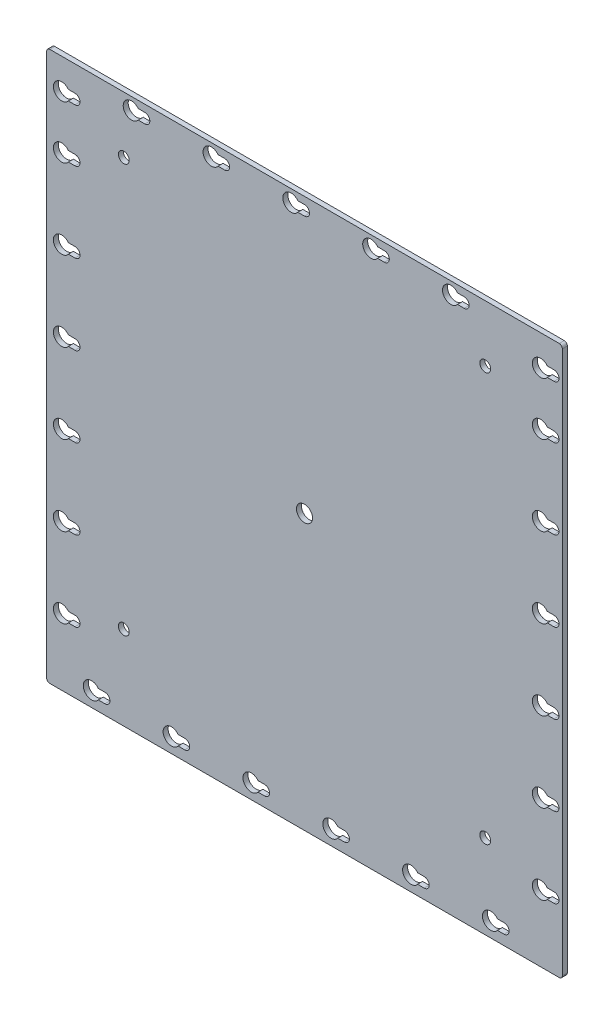
from build123d import *

# Parameters (mm, degrees)
SKETCH1_W               = 164.1
SKETCH1_H               = 174.745
SKETCH1_R               = 2.5527
BOSS_EXTRUDE1_DEPTH     = 1.5875
FILLET1_R               = 1
CUT_EXTRUDE1_DEPTH      = 241.065605994
CUT_EXTRUDE1_DEPTH_BACK = 241.065605994
SKETCH2_R               = 1.725


with BuildPart() as part:
    # Sketch1 → Boss-Extrude1 (new body)
    with BuildSketch(Plane.XY):
        with Locations((82.55, -87.3725)):
            Rectangle(SKETCH1_W, SKETCH1_H)
        with Locations((82.55, -87.3725)):
            Circle(SKETCH1_R, mode=Mode.SUBTRACT)
        with BuildLine():
            Line((82.55, -5.4375), (80.434372699, -5.4375))
            ThreePointArc((80.434372699, -5.4375), (75.6625, -3.85), (80.434372699, -2.2625))
            Line((80.434372699, -2.2625), (82.55, -2.2625))
            ThreePointArc((82.55, -2.2625), (84.1375, -3.85), (82.55, -5.4375))
        make_face(mode=Mode.SUBTRACT)
        with BuildLine():
            Line((16.934372699, -168.395), (19.05, -168.395))
            ThreePointArc((19.05, -168.395), (20.6375, -169.9825), (19.05, -171.57))
            Line((19.05, -171.57), (16.934372699, -171.57))
            ThreePointArc((16.934372699, -171.57), (12.1625, -169.9825), (16.934372699, -168.395))
        make_face(mode=Mode.SUBTRACT)
        with BuildLine():
            Line((7.409372699, -151.9325), (9.525, -151.9325))
            ThreePointArc((9.525, -151.9325), (11.1125, -153.52), (9.525, -155.1075))
            Line((9.525, -155.1075), (7.409372699, -155.1075))
            ThreePointArc((7.409372699, -155.1075), (2.6375, -153.52), (7.409372699, -151.9325))
        make_face(mode=Mode.SUBTRACT)
        with BuildLine():
            Line((42.334372699, -168.395), (44.45, -168.395))
            ThreePointArc((44.45, -168.395), (46.0375, -169.9825), (44.45, -171.57))
            Line((44.45, -171.57), (42.334372699, -171.57))
            ThreePointArc((42.334372699, -171.57), (37.5625, -169.9825), (42.334372699, -168.395))
        make_face(mode=Mode.SUBTRACT)
        with BuildLine():
            Line((67.734372699, -168.395), (69.85, -168.395))
            ThreePointArc((69.85, -168.395), (71.4375, -169.9825), (69.85, -171.57))
            Line((69.85, -171.57), (67.734372699, -171.57))
            ThreePointArc((67.734372699, -171.57), (62.9625, -169.9825), (67.734372699, -168.395))
        make_face(mode=Mode.SUBTRACT)
        with BuildLine():
            Line((7.409372699, -126.5325), (9.525, -126.5325))
            ThreePointArc((9.525, -126.5325), (11.1125, -128.12), (9.525, -129.7075))
            Line((9.525, -129.7075), (7.409372699, -129.7075))
            ThreePointArc((7.409372699, -129.7075), (2.6375, -128.12), (7.409372699, -126.5325))
        make_face(mode=Mode.SUBTRACT)
        with BuildLine():
            Line((7.409372699, -101.1325), (9.525, -101.1325))
            ThreePointArc((9.525, -101.1325), (11.1125, -102.72), (9.525, -104.3075))
            Line((9.525, -104.3075), (7.409372699, -104.3075))
            ThreePointArc((7.409372699, -104.3075), (2.6375, -102.72), (7.409372699, -101.1325))
        make_face(mode=Mode.SUBTRACT)
        with BuildLine():
            Line((7.409372699, -75.7325), (9.525, -75.7325))
            ThreePointArc((9.525, -75.7325), (11.1125, -77.32), (9.525, -78.9075))
            Line((9.525, -78.9075), (7.409372699, -78.9075))
            ThreePointArc((7.409372699, -78.9075), (2.6375, -77.32), (7.409372699, -75.7325))
        make_face(mode=Mode.SUBTRACT)
        with BuildLine():
            Line((7.409372699, -50.3325), (9.525, -50.3325))
            ThreePointArc((9.525, -50.3325), (11.1125, -51.92), (9.525, -53.5075))
            Line((9.525, -53.5075), (7.409372699, -53.5075))
            ThreePointArc((7.409372699, -53.5075), (2.6375, -51.92), (7.409372699, -50.3325))
        make_face(mode=Mode.SUBTRACT)
        with BuildLine():
            Line((7.409372699, -24.9325), (9.525, -24.9325))
            ThreePointArc((9.525, -24.9325), (11.1125, -26.52), (9.525, -28.1075))
            Line((9.525, -28.1075), (7.409372699, -28.1075))
            ThreePointArc((7.409372699, -28.1075), (2.6375, -26.52), (7.409372699, -24.9325))
        make_face(mode=Mode.SUBTRACT)
        with BuildLine():
            Line((7.409372699, -8.1), (9.525, -8.1))
            ThreePointArc((9.525, -8.1), (11.1125, -9.6875), (9.525, -11.275))
            Line((9.525, -11.275), (7.409372699, -11.275))
            ThreePointArc((7.409372699, -11.275), (2.6375, -9.6875), (7.409372699, -8.1))
        make_face(mode=Mode.SUBTRACT)
        with BuildLine():
            Line((29.634372699, -2.2625), (31.75, -2.2625))
            ThreePointArc((31.75, -2.2625), (33.3375, -3.85), (31.75, -5.4375))
            Line((31.75, -5.4375), (29.634372699, -5.4375))
            ThreePointArc((29.634372699, -5.4375), (24.8625, -3.85), (29.634372699, -2.2625))
        make_face(mode=Mode.SUBTRACT)
        with BuildLine():
            Line((55.034372699, -2.2625), (57.15, -2.2625))
            ThreePointArc((57.15, -2.2625), (58.7375, -3.85), (57.15, -5.4375))
            Line((57.15, -5.4375), (55.034372699, -5.4375))
            ThreePointArc((55.034372699, -5.4375), (50.2625, -3.85), (55.034372699, -2.2625))
        make_face(mode=Mode.SUBTRACT)
        with BuildLine():
            ThreePointArc((161.925, -8.1), (163.5125, -9.6875), (161.925, -11.275))
            Line((161.925, -11.275), (159.809372699, -11.275))
            ThreePointArc((159.809372699, -11.275), (155.0375, -9.6875), (159.809372699, -8.1))
            Line((159.809372699, -8.1), (161.925, -8.1))
        make_face(mode=Mode.SUBTRACT)
        with BuildLine():
            Line((93.134372699, -168.395), (95.25, -168.395))
            ThreePointArc((95.25, -168.395), (96.8375, -169.9825), (95.25, -171.57))
            Line((95.25, -171.57), (93.134372699, -171.57))
            ThreePointArc((93.134372699, -171.57), (88.3625, -169.9825), (93.134372699, -168.395))
        make_face(mode=Mode.SUBTRACT)
        with BuildLine():
            Line((118.534372699, -168.395), (120.65, -168.395))
            ThreePointArc((120.65, -168.395), (122.2375, -169.9825), (120.65, -171.57))
            Line((120.65, -171.57), (118.534372699, -171.57))
            ThreePointArc((118.534372699, -171.57), (113.7625, -169.9825), (118.534372699, -168.395))
        make_face(mode=Mode.SUBTRACT)
        with BuildLine():
            Line((143.934372699, -168.395), (146.05, -168.395))
            ThreePointArc((146.05, -168.395), (147.6375, -169.9825), (146.05, -171.57))
            Line((146.05, -171.57), (143.934372699, -171.57))
            ThreePointArc((143.934372699, -171.57), (139.1625, -169.9825), (143.934372699, -168.395))
        make_face(mode=Mode.SUBTRACT)
        with BuildLine():
            Line((159.809372699, -151.9325), (161.925, -151.9325))
            ThreePointArc((161.925, -151.9325), (163.5125, -153.52), (161.925, -155.1075))
            Line((161.925, -155.1075), (159.809372699, -155.1075))
            ThreePointArc((159.809372699, -155.1075), (155.0375, -153.52), (159.809372699, -151.9325))
        make_face(mode=Mode.SUBTRACT)
        with BuildLine():
            Line((159.809372699, -126.5325), (161.925, -126.5325))
            ThreePointArc((161.925, -126.5325), (163.5125, -128.12), (161.925, -129.7075))
            Line((161.925, -129.7075), (159.809372699, -129.7075))
            ThreePointArc((159.809372699, -129.7075), (155.0375, -128.12), (159.809372699, -126.5325))
        make_face(mode=Mode.SUBTRACT)
        with BuildLine():
            Line((159.809372699, -101.1325), (161.925, -101.1325))
            ThreePointArc((161.925, -101.1325), (163.5125, -102.72), (161.925, -104.3075))
            Line((161.925, -104.3075), (159.809372699, -104.3075))
            ThreePointArc((159.809372699, -104.3075), (155.0375, -102.72), (159.809372699, -101.1325))
        make_face(mode=Mode.SUBTRACT)
        with BuildLine():
            Line((159.809372699, -75.7325), (161.925, -75.7325))
            ThreePointArc((161.925, -75.7325), (163.5125, -77.32), (161.925, -78.9075))
            Line((161.925, -78.9075), (159.809372699, -78.9075))
            ThreePointArc((159.809372699, -78.9075), (155.0375, -77.32), (159.809372699, -75.7325))
        make_face(mode=Mode.SUBTRACT)
        with BuildLine():
            Line((159.809372699, -50.3325), (161.925, -50.3325))
            ThreePointArc((161.925, -50.3325), (163.5125, -51.92), (161.925, -53.5075))
            Line((161.925, -53.5075), (159.809372699, -53.5075))
            ThreePointArc((159.809372699, -53.5075), (155.0375, -51.92), (159.809372699, -50.3325))
        make_face(mode=Mode.SUBTRACT)
        with BuildLine():
            Line((105.834372699, -2.2625), (107.95, -2.2625))
            ThreePointArc((107.95, -2.2625), (109.5375, -3.85), (107.95, -5.4375))
            Line((107.95, -5.4375), (105.834372699, -5.4375))
            ThreePointArc((105.834372699, -5.4375), (101.0625, -3.85), (105.834372699, -2.2625))
        make_face(mode=Mode.SUBTRACT)
        with BuildLine():
            Line((159.809372699, -24.9325), (161.925, -24.9325))
            ThreePointArc((161.925, -24.9325), (163.5125, -26.52), (161.925, -28.1075))
            Line((161.925, -28.1075), (159.809372699, -28.1075))
            ThreePointArc((159.809372699, -28.1075), (155.0375, -26.52), (159.809372699, -24.9325))
        make_face(mode=Mode.SUBTRACT)
        with BuildLine():
            Line((131.234372699, -2.2625), (133.35, -2.2625))
            ThreePointArc((133.35, -2.2625), (134.9375, -3.85), (133.35, -5.4375))
            Line((133.35, -5.4375), (131.234372699, -5.4375))
            ThreePointArc((131.234372699, -5.4375), (126.4625, -3.85), (131.234372699, -2.2625))
        make_face(mode=Mode.SUBTRACT)
    extrude(amount=BOSS_EXTRUDE1_DEPTH)

    # Fillet1
    fillet1_edges = [part.edges().sort_by_distance(p)[0] for p in [
        (0.5, -174.745, 0.79375),
        (0.5, 0, 0.79375),
        (164.6, 0, 0.79375),
        (164.6, -174.745, 0.79375),
    ]]
    fillet(fillet1_edges, radius=FILLET1_R)

    # Sketch2 → Cut-Extrude1 (cut, two sides: drawn at the far end of the back side and taken through both)
    with BuildSketch(Plane.XY.offset(1.5875).offset(-CUT_EXTRUDE1_DEPTH_BACK)):
        with Locations((25.05, -18)):
            Circle(SKETCH2_R)
        with Locations((140.05, -18)):
            Circle(SKETCH2_R)
        with Locations((140.05, -148)):
            Circle(SKETCH2_R)
        with Locations((25.05, -148)):
            Circle(SKETCH2_R)
    extrude(amount=CUT_EXTRUDE1_DEPTH + CUT_EXTRUDE1_DEPTH_BACK, mode=Mode.SUBTRACT)


solid = part.part
